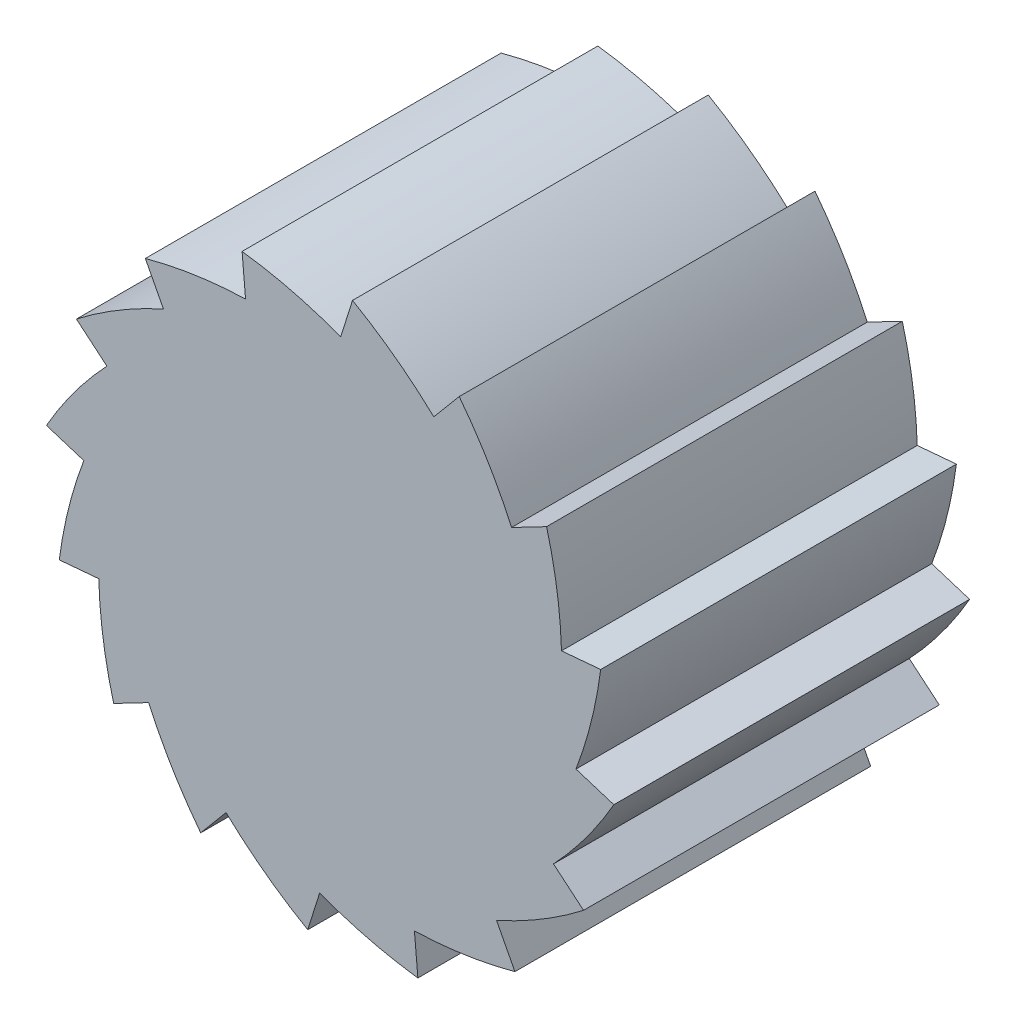
from build123d import *

# Parameters (mm, degrees)
BOSS_EXTRUDE3_DEPTH = 5


with BuildPart() as part:
    # Sketch1 → Boss-Extrude3 (new body)
    with BuildSketch(Plane.XY):
        with BuildLine():
            Line((3.261099582, 1.194049175), (3.81171563, 1.242385454))
            ThreePointArc((3.81171563, 1.242385454), (3.679113284, 0.539346603), (3.464772438, -0.143225745))
            Line((3.464772438, -0.143225745), (3.997006384, -0.310865928))
            ThreePointArc((3.997006384, -0.310865928), (3.606544346, -0.90817684), (3.148727576, -1.455574989))
            Line((3.148727576, -1.455574989), (3.570884713, -1.8095948))
            ThreePointArc((3.570884713, -1.8095948), (2.981242264, -2.212207675), (2.348432127, -2.542853522))
            Line((2.348432127, -2.542853522), (2.60656535, -3.038366017))
            ThreePointArc((2.60656535, -3.038366017), (1.906611892, -3.184852059), (1.194293663, -3.248063959))
            Line((1.194293663, -3.248063959), (1.242515605, -3.797377559))
            ThreePointArc((1.242515605, -3.797377559), (0.542181479, -3.66545179), (-0.137882302, -3.452412943))
            Line((-0.137882302, -3.452412943), (-0.305258742, -3.983809541))
            ThreePointArc((-0.305258742, -3.983809541), (-0.904553156, -3.591877018), (-1.453561846, -3.132144098))
            Line((-1.453561846, -3.132144098), (-1.809464649, -3.556546643))
            ThreePointArc((-1.809464649, -3.556546643), (-2.211164681, -2.968425537), (-2.541266837, -2.337329731))
            Line((-2.541266837, -2.337329731), (-3.03275883, -2.593368507))
            ThreePointArc((-3.03275883, -2.593368507), (-3.17936368, -1.892614543), (-3.242504481, -1.179478974))
            Line((-3.242504481, -1.179478974), (-3.797247408, -1.228177535))
            ThreePointArc((-3.797247408, -1.228177535), (-3.665254009, -0.527572813), (-3.452085069, 0.152741995))
            Line((-3.452085069, 0.152741995), (-3.978202355, 0.318455585))
            ThreePointArc((-3.978202355, 0.318455585), (-3.587058838, 0.916685937), (-3.128354184, 1.464830849))
            Line((-3.128354184, 1.464830849), (-3.556416492, 1.823802719))
            ThreePointArc((-3.556416492, 1.823802719), (-2.966435761, 2.226618489), (-2.333244393, 2.55738502))
            Line((-2.333244393, 2.55738502), (-2.587761321, 3.045955674))
            ThreePointArc((-2.587761321, 3.045955674), (-1.889660833, 3.19216629), (-1.179234612, 3.255541529))
            Line((-1.179234612, 3.255541529), (-1.228047384, 3.811585479))
            ThreePointArc((-1.228047384, 3.811585479), (-0.524737953, 3.678915376), (0.158085284, 3.464444075))
            Line((0.158085284, 3.464444075), (0.324062771, 3.991399198))
            ThreePointArc((0.324062771, 3.991399198), (0.92030935, 3.601725697), (1.466842606, 3.144936008))
            Line((1.466842606, 3.144936008), (1.82393287, 3.570754562))
            ThreePointArc((1.82393287, 3.570754562), (2.227660979, 2.979252099), (2.558969454, 2.344345616))
            Line((2.558969454, 2.344345616), (3.05156286, 2.600958164))
            ThreePointArc((3.05156286, 2.600958164), (3.197654322, 1.903658089), (3.261099582, 1.194049175))
        make_face()
    extrude(amount=BOSS_EXTRUDE3_DEPTH)


solid = part.part
